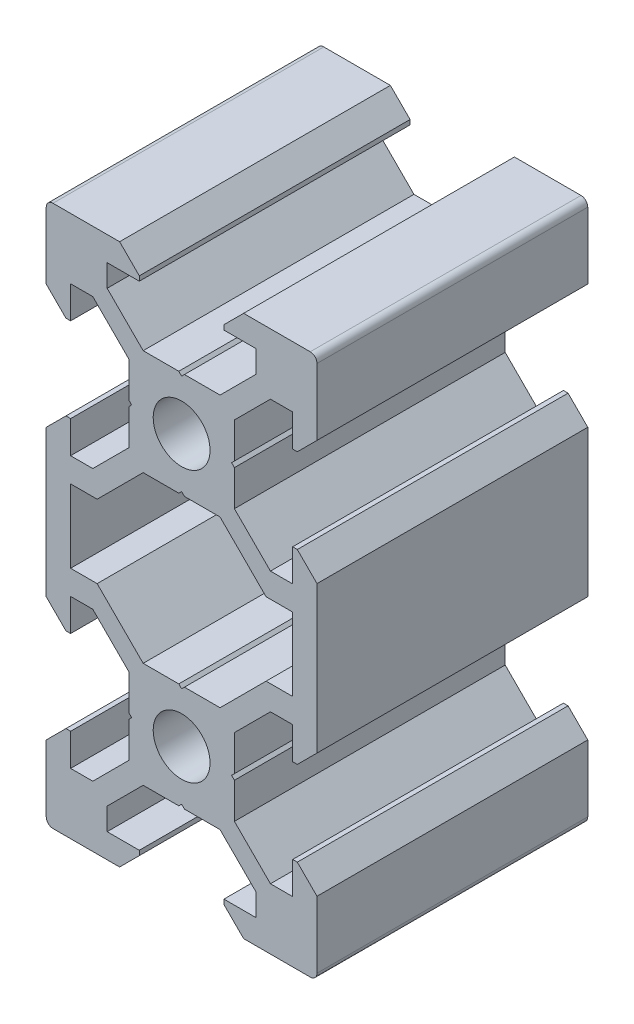
from build123d import *
from build123d.topology import SkipClean

# Parameters (mm, degrees)
BOSS_EXTRU_1_DEPTH     = 20
SYM_TRIE6_COPY_1_DEPTH = 20


with BuildPart() as part:
    # Esquisse1 → Boss.-Extru.1 (new body)
    with BuildSketch(Plane.XY):
        with BuildLine():
            Line((-9.5, 10), (-4.58, 10))
            Line((-4.58, 10), (-3.125, 8.545))
            Line((-3.125, 8.545), (-3.125, 8.2))
            Line((-3.125, 8.2), (-5.5, 8.2))
            Line((-5.5, 8.2), (-5.5, 6.560660172))
            Line((-5.5, 6.560660172), (-2.839339828, 3.9))
            Line((-2.839339828, 3.9), (-0.21, 3.9))
            Line((-0.21, 3.9), (0, 3.69))
            Line((0, 3.69), (0, 2.1))
            ThreePointArc((0, 2.1), (-2.1, 0), (0, -2.1))
            Line((0, -2.1), (0, -3.69))
            Line((0, -3.69), (-0.21, -3.9))
            Line((-0.21, -3.9), (-2.839339828, -3.9))
            Line((-2.839339828, -3.9), (-6.239339828, -7.3))
            Line((-6.239339828, -7.3), (-8.2, -7.3))
            Line((-8.2, -7.3), (-8.2, -10))
            Line((-8.2, -10), (-10, -10))
            Line((-10, -10), (-10, -4.58))
            Line((-10, -4.58), (-8.545, -3.125))
            Line((-8.545, -3.125), (-8.2, -3.125))
            Line((-8.2, -3.125), (-8.2, -5.5))
            Line((-8.2, -5.5), (-6.560660172, -5.5))
            Line((-6.560660172, -5.5), (-3.9, -2.839339828))
            Line((-3.9, -2.839339828), (-3.9, -0.21))
            Line((-3.9, -0.21), (-3.69, 0))
            Line((-3.69, 0), (-3.9, 0.21))
            Line((-3.9, 0.21), (-3.9, 2.839339828))
            Line((-3.9, 2.839339828), (-6.560660172, 5.5))
            Line((-6.560660172, 5.5), (-8.2, 5.5))
            Line((-8.2, 5.5), (-8.2, 3.125))
            Line((-8.2, 3.125), (-8.545, 3.125))
            Line((-8.545, 3.125), (-10, 4.58))
            Line((-10, 4.58), (-10, 9.5))
            ThreePointArc((-10, 9.5), (-9.853553391, 9.853553391), (-9.5, 10))
        make_face()
    boss_extru_1 = extrude(amount=BOSS_EXTRU_1_DEPTH)

    # Symétrie1: Boss.-Extru.1 across plane
    add(boss_extru_1.mirror(Plane(origin=(0, 3.69, 20), x_dir=(0, 0, 1), z_dir=(-1, 0, 0))))

    # Symétrie6: Boss.-Extru.1 across plane
    add(boss_extru_1.mirror(Plane(origin=(-8.2, -10, 20), x_dir=(0, 0, 1), z_dir=(0, 1, 0))))

    # Symétrie6 copy 1 sketch → Symétrie6 copy 1 (add)
    with SkipClean():  # the faces are left unmerged after this step: merging them gives an invalid solid
        with BuildSketch(Plane(origin=(0, -20, 0), x_dir=(-1, 0, 0), z_dir=(0, 0, 1))):
            with BuildLine():
                Line((-9.5, 10), (-4.58, 10))
                Line((-4.58, 10), (-3.125, 8.545))
                Line((-3.125, 8.545), (-3.125, 8.2))
                Line((-3.125, 8.2), (-5.5, 8.2))
                Line((-5.5, 8.2), (-5.5, 6.560660172))
                Line((-5.5, 6.560660172), (-2.839339828, 3.9))
                Line((-2.839339828, 3.9), (-0.21, 3.9))
                Line((-0.21, 3.9), (0, 3.69))
                Line((0, 3.69), (0, 2.1))
                ThreePointArc((0, 2.1), (-2.1, 0), (0, -2.1))
                Line((0, -2.1), (0, -3.69))
                Line((0, -3.69), (-0.21, -3.9))
                Line((-0.21, -3.9), (-2.839339828, -3.9))
                Line((-2.839339828, -3.9), (-6.239339828, -7.3))
                Line((-6.239339828, -7.3), (-8.2, -7.3))
                Line((-8.2, -7.3), (-8.2, -10))
                Line((-8.2, -10), (-10, -10))
                Line((-10, -10), (-10, -4.58))
                Line((-10, -4.58), (-8.545, -3.125))
                Line((-8.545, -3.125), (-8.2, -3.125))
                Line((-8.2, -3.125), (-8.2, -5.5))
                Line((-8.2, -5.5), (-6.560660172, -5.5))
                Line((-6.560660172, -5.5), (-3.9, -2.839339828))
                Line((-3.9, -2.839339828), (-3.9, -0.21))
                Line((-3.9, -0.21), (-3.69, 0))
                Line((-3.69, 0), (-3.9, 0.21))
                Line((-3.9, 0.21), (-3.9, 2.839339828))
                Line((-3.9, 2.839339828), (-6.560660172, 5.5))
                Line((-6.560660172, 5.5), (-8.2, 5.5))
                Line((-8.2, 5.5), (-8.2, 3.125))
                Line((-8.2, 3.125), (-8.545, 3.125))
                Line((-8.545, 3.125), (-10, 4.58))
                Line((-10, 4.58), (-10, 9.5))
                ThreePointArc((-10, 9.5), (-9.853553391, 9.853553391), (-9.5, 10))
            make_face()
        extrude(amount=SYM_TRIE6_COPY_1_DEPTH)


solid = part.part
